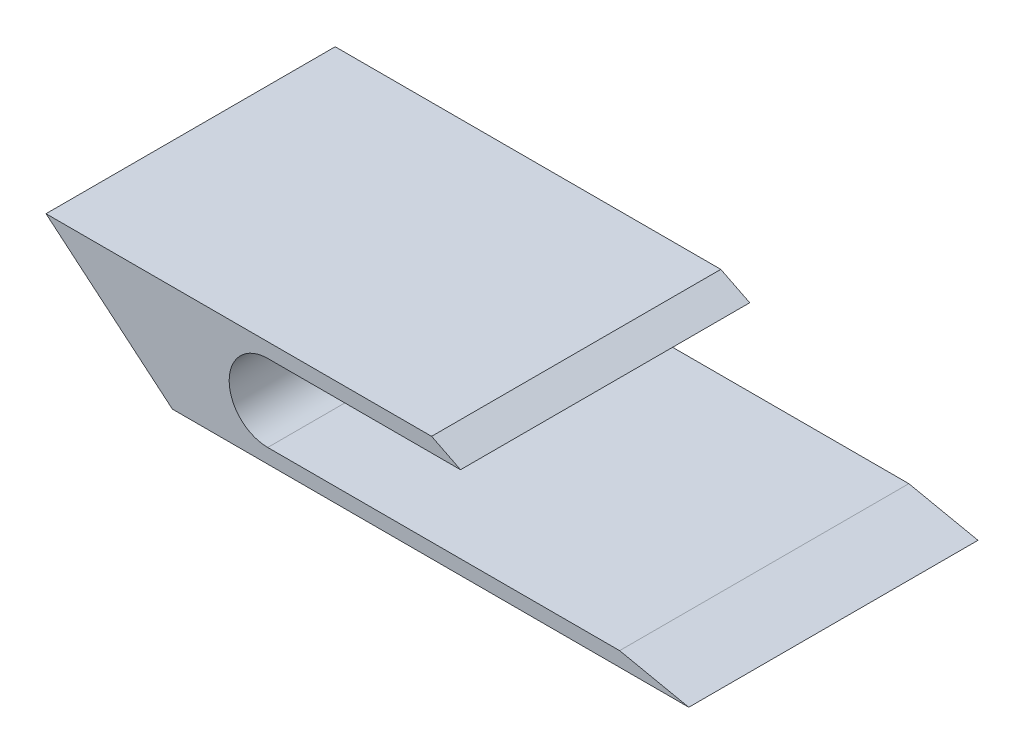
from build123d import *

# Parameters (mm, degrees)
BOSS_EXTRUDE1_DEPTH = 30


with BuildPart() as part:
    # Sketch1 → Boss-Extrude1 (new body)
    with BuildSketch(Plane.XY):
        with BuildLine():
            Line((0, 4), (20, 4))
            Line((20, 4), (16.999564626, 5.5))
            Line((16.999564626, 5.5), (-23.000435374, 5.5))
            Line((-23.000435374, 5.5), (-9.891145856, -5.5))
            Line((-9.891145856, -5.5), (43.679568359, -5.5))
            Line((43.679568359, -5.5), (36.50360504, -4))
            Line((36.50360504, -4), (0, -4))
            ThreePointArc((0, -4), (-4, 0), (0, 4))
        make_face()
    extrude(amount=BOSS_EXTRUDE1_DEPTH)


solid = part.part
